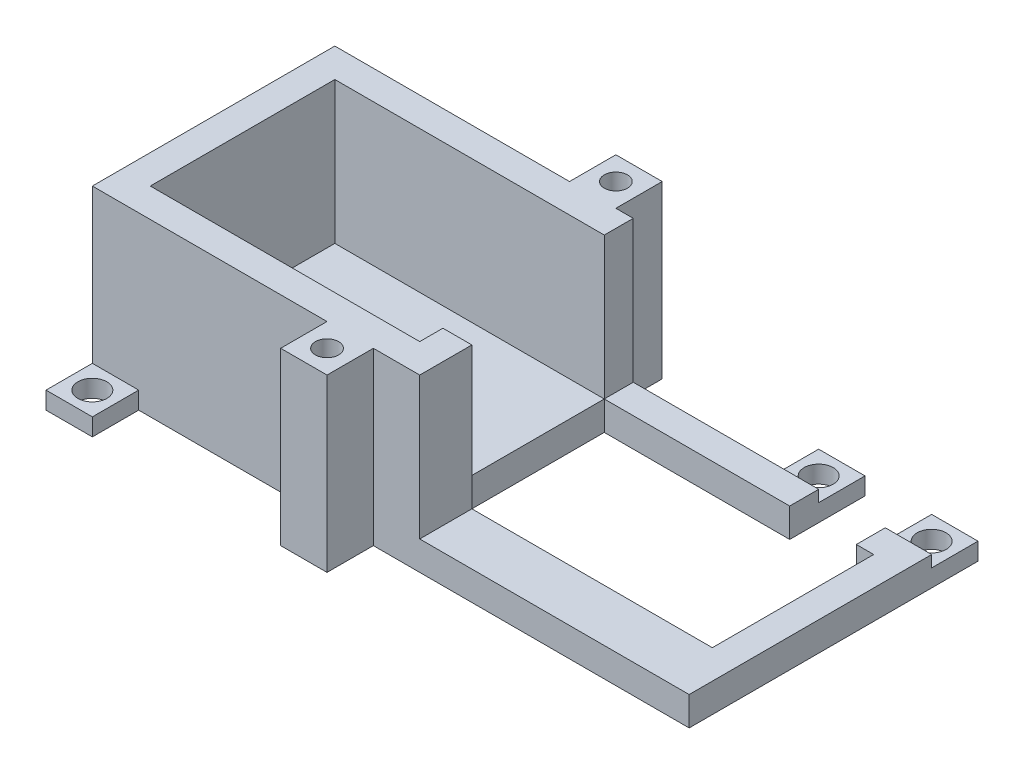
from build123d import *

# Parameters (mm, degrees)
BOSS_EXTRUDE1_DEPTH = 24.5
SKETCH2_W           = 103
SKETCH2_H           = 41.85
BOSS_EXTRUDE2_DEPTH = 5
SKETCH3_W           = 46.5
SKETCH3_H           = 27.85
CUT_EXTRUDE1_DEPTH  = 26
SKETCH7_W           = 8
SKETCH7_H           = 3
BOSS_EXTRUDE3_DEPTH = 8
SKETCH8_R           = 2.5
CUT_EXTRUDE2_DEPTH  = 8
SKETCH9_W           = 8
SKETCH9_H           = 3
BOSS_EXTRUDE4_DEPTH = 8
SKETCH10_R          = 2.5
CUT_EXTRUDE3_DEPTH  = 8
SKETCH12_W          = 11.5
SKETCH12_H          = 5
CUT_EXTRUDE4_DEPTH  = 8
SKETCH14_W          = 8
SKETCH14_H          = 3
BOSS_EXTRUDE5_DEPTH = 8
SKETCH15_R          = 2.5
CUT_EXTRUDE5_DEPTH  = 8
SKETCH16_W          = 8
SKETCH16_H          = 29.5
BOSS_EXTRUDE6_DEPTH = 8
SKETCH17_W          = 8
SKETCH17_H          = 29.5
BOSS_EXTRUDE7_DEPTH = 8
SKETCH18_R          = 2
CUT_EXTRUDE6_DEPTH  = 10


with BuildPart() as part:
    # Sketch1 → Boss-Extrude1 (new body)
    with BuildSketch(Plane(origin=(0, 0, 0), x_dir=(1, 0, 0), z_dir=(0, 1, 0))):
        Polygon((0, 0), (51.5, 0), (51.5, -5), (5, -5), (5, -36.85), (51.5, -36.85), (51.5, -32.85), (56.5, -32.85), (56.5, -41.85), (0, -41.85), align=None)
    extrude(amount=BOSS_EXTRUDE1_DEPTH)

    # Sketch2 → Boss-Extrude2 (add)
    with BuildSketch(Plane.XZ):
        with Locations((51.5, 20.925)):
            Rectangle(SKETCH2_W, SKETCH2_H)
    extrude(amount=BOSS_EXTRUDE2_DEPTH)

    # Sketch3 → Cut-Extrude1 (cut)
    with BuildSketch(Plane(origin=(0, 0, 0), x_dir=(1, 0, 0), z_dir=(0, 1, 0))):
        with Locations((74.75, -18.925)):
            Rectangle(SKETCH3_W, SKETCH3_H)
    extrude(amount=-CUT_EXTRUDE1_DEPTH, mode=Mode.SUBTRACT)

    # Sketch7 → Boss-Extrude3 (add)
    with BuildSketch(Plane.XY.offset(41.85)):
        with Locations((4, -3.5)):
            Rectangle(SKETCH7_W, SKETCH7_H)
    extrude(amount=BOSS_EXTRUDE3_DEPTH)

    # Sketch8 → Cut-Extrude2 (cut)
    with BuildSketch(Plane(origin=(0, -2, 0), x_dir=(1, 0, 0), z_dir=(0, 1, 0))):
        with Locations(Location((4, -45.85, 0), (0, 0, 270))):
            Circle(SKETCH8_R)
    extrude(amount=-CUT_EXTRUDE2_DEPTH, mode=Mode.SUBTRACT)

    # Sketch9 → Boss-Extrude4 (add)
    with BuildSketch(Plane(origin=(0, 0, 0), x_dir=(-1, 0, 0), z_dir=(0, 0, -1))):
        with Locations((-99, -3.5)):
            Rectangle(SKETCH9_W, SKETCH9_H)
    extrude(amount=BOSS_EXTRUDE4_DEPTH)

    # Sketch10 → Cut-Extrude3 (cut)
    with BuildSketch(Plane(origin=(0, -2, 0), x_dir=(1, 0, 0), z_dir=(0, 1, 0))):
        with Locations(Location((99, 3.996680608, 0), (0, 0, 270))):
            Circle(SKETCH10_R)
    extrude(amount=-CUT_EXTRUDE3_DEPTH, mode=Mode.SUBTRACT)

    # Sketch12 → Cut-Extrude4 (cut)
    with BuildSketch(Plane(origin=(0, 0, 0), x_dir=(1, 0, 0), z_dir=(0, 1, 0))):
        with Locations((89.25, -2.5)):
            Rectangle(SKETCH12_W, SKETCH12_H)
    extrude(amount=-CUT_EXTRUDE4_DEPTH, mode=Mode.SUBTRACT)

    # Sketch14 → Boss-Extrude5 (add)
    with BuildSketch(Plane(origin=(0, 0, 0), x_dir=(-1, 0, 0), z_dir=(0, 0, -1))):
        with Locations((-79.5, -3.5)):
            Rectangle(SKETCH14_W, SKETCH14_H)
    extrude(amount=BOSS_EXTRUDE5_DEPTH)

    # Sketch15 → Cut-Extrude5 (cut)
    with BuildSketch(Plane(origin=(0, -2, 0), x_dir=(1, 0, 0), z_dir=(0, 1, 0))):
        with Locations(Location((79.5, 4, 0), (0, 0, 270))):
            Circle(SKETCH15_R)
    extrude(amount=-CUT_EXTRUDE5_DEPTH, mode=Mode.SUBTRACT)

    # Sketch16 → Boss-Extrude6 (add)
    with BuildSketch(Plane(origin=(0, 0, 0), x_dir=(-1, 0, 0), z_dir=(0, 0, -1))):
        with Locations((-44.5, 9.75)):
            Rectangle(SKETCH16_W, SKETCH16_H)
    extrude(amount=BOSS_EXTRUDE6_DEPTH)

    # Sketch17 → Boss-Extrude7 (add)
    with BuildSketch(Plane.XY.offset(41.85)):
        with Locations((44.5, 9.75)):
            Rectangle(SKETCH17_W, SKETCH17_H)
    extrude(amount=BOSS_EXTRUDE7_DEPTH)

    # Sketch18 → Cut-Extrude6 (cut)
    with BuildSketch(Plane(origin=(0, 24.5, 0), x_dir=(1, 0, 0), z_dir=(0, 1, 0))):
        with Locations(Location((44.5, 4, 0), (0, 0, 270))):
            Circle(SKETCH18_R)
        with Locations(Location((44.5, -45.85, 0), (0, 0, 270))):
            Circle(SKETCH18_R)
    extrude(amount=-CUT_EXTRUDE6_DEPTH, mode=Mode.SUBTRACT)


solid = part.part
